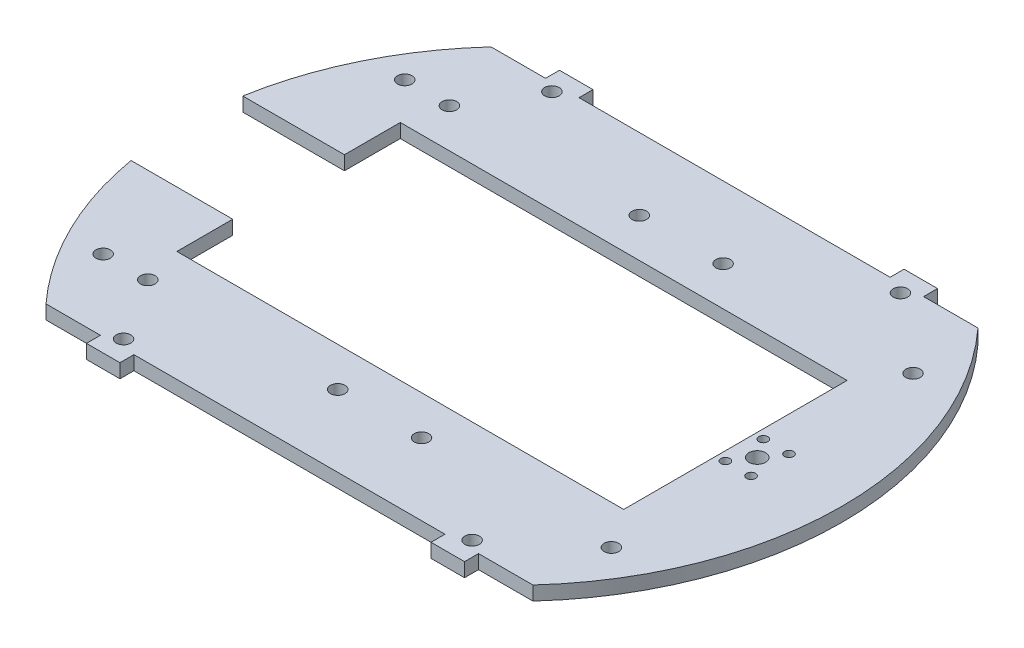
from build123d import *

# Parameters (mm, degrees)
SKETCH1_R           = 1.651
SKETCH1_R_2         = 1.905
SKETCH1_R_3         = 1.016
SKETCH1_W           = 101.6
SKETCH1_H           = 50.8
BOSS_EXTRUDE1_DEPTH = 3.175
SKETCH3_W           = 23.116912814
SKETCH3_H           = 25.4
CUT_EXTRUDE2_DEPTH  = 3.175


with BuildPart() as part:
    # Sketch1 → Boss-Extrude1 (new body)
    with BuildSketch(Plane(origin=(0, 0, 0), x_dir=(1, 0, 0), z_dir=(0, 1, 0))):
        with BuildLine():
            Line((-73.916912814, 12.7), (-73.916912814, -12.7))
            ThreePointArc((-73.916912814, -12.7), (-67.357563081, -32.984218889), (-55.35602635, -50.603461806))
            Line((-55.35602635, -50.603461806), (-42.984152136, -50.603461806))
            Line((-42.984152136, -50.603461806), (-42.984152136, -53.778461806))
            Line((-42.984152136, -53.778461806), (-35.364152136, -53.778461806))
            Line((-35.364152136, -53.778461806), (-35.364152136, -50.603461806))
            Line((-35.364152136, -50.603461806), (35.364152136, -50.603461806))
            Line((35.364152136, -50.603461806), (35.364152136, -53.778461806))
            Line((35.364152136, -53.778461806), (42.984152136, -53.778461806))
            Line((42.984152136, -53.778461806), (42.984152136, -50.603461806))
            Line((42.984152136, -50.603461806), (55.35602635, -50.603461806))
            ThreePointArc((55.35602635, -50.603461806), (75, 0), (55.35602635, 50.603461806))
            Line((55.35602635, 50.603461806), (42.984152136, 50.603461806))
            Line((42.984152136, 50.603461806), (42.984152136, 53.778461806))
            Line((42.984152136, 53.778461806), (35.364152136, 53.778461806))
            Line((35.364152136, 53.778461806), (35.364152136, 50.603461806))
            Line((35.364152136, 50.603461806), (-35.364152136, 50.603461806))
            Line((-35.364152136, 50.603461806), (-35.364152136, 53.778461806))
            Line((-35.364152136, 53.778461806), (-42.984152136, 53.778461806))
            Line((-42.984152136, 53.778461806), (-42.984152136, 50.603461806))
            Line((-42.984152136, 50.603461806), (-55.35602635, 50.603461806))
            ThreePointArc((-55.35602635, 50.603461806), (-67.357563081, 32.984218889), (-73.916912814, 12.7))
        make_face()
        with Locations(Location((13.713087186, 34.29, 0), (0, 0, 270))):
            Circle(SKETCH1_R, mode=Mode.SUBTRACT)
        with Locations(Location((-58.676912814, -34.29, 0), (0, 0, 270))):
            Circle(SKETCH1_R, mode=Mode.SUBTRACT)
        with Locations(Location((-58.676912814, 34.29, 0), (0, 0, 270))):
            Circle(SKETCH1_R, mode=Mode.SUBTRACT)
        with Locations(Location((-39.626912814, 48.698461806, 0), (0, 0, 270))):
            Circle(SKETCH1_R, mode=Mode.SUBTRACT)
        with Locations(Location((39.626912814, 48.698461806, 0), (0, 0, 270))):
            Circle(SKETCH1_R, mode=Mode.SUBTRACT)
        with Locations(Location((-39.626912814, -48.698461806, 0), (0, 0, 270))):
            Circle(SKETCH1_R, mode=Mode.SUBTRACT)
        with Locations(Location((39.626912814, -48.698461806, 0), (0, 0, 270))):
            Circle(SKETCH1_R, mode=Mode.SUBTRACT)
        with Locations(Location((56.893087186, 34.29, 0), (0, 0, 270))):
            Circle(SKETCH1_R, mode=Mode.SUBTRACT)
        with Locations(Location((-48.516912814, 34.29, 0), (0, 0, 270))):
            Circle(SKETCH1_R, mode=Mode.SUBTRACT)
        with Locations(Location((-5.336912814, 34.29, 0), (0, 0, 270))):
            Circle(SKETCH1_R, mode=Mode.SUBTRACT)
        with Locations(Location((-5.336912814, -34.29, 0), (0, 0, 270))):
            Circle(SKETCH1_R, mode=Mode.SUBTRACT)
        with Locations(Location((-48.516912814, -34.29, 0), (0, 0, 270))):
            Circle(SKETCH1_R, mode=Mode.SUBTRACT)
        with Locations(Location((13.713087186, -34.29, 0), (0, 0, 270))):
            Circle(SKETCH1_R, mode=Mode.SUBTRACT)
        with Locations(Location((56.893087186, -34.29, 0), (0, 0, 270))):
            Circle(SKETCH1_R, mode=Mode.SUBTRACT)
        with Locations(Location((55.751543593, 0, 0), (0, 0, 270))):
            Circle(SKETCH1_R_2, mode=Mode.SUBTRACT)
        with Locations(Location((58.671087186, 4.318, 0), (0, 0, 270))):
            Circle(SKETCH1_R_3, mode=Mode.SUBTRACT)
        with Locations(Location((58.671087186, -4.318, 0), (0, 0, 270))):
            Circle(SKETCH1_R_3, mode=Mode.SUBTRACT)
        with Locations(Location((52.832, -4.318, 0), (0, 0, 270))):
            Circle(SKETCH1_R_3, mode=Mode.SUBTRACT)
        with Locations(Location((52.832, 4.318, 0), (0, 0, 270))):
            Circle(SKETCH1_R_3, mode=Mode.SUBTRACT)
        Rectangle(SKETCH1_W, SKETCH1_H, mode=Mode.SUBTRACT)
    extrude(amount=BOSS_EXTRUDE1_DEPTH)

    # Sketch3 → Cut-Extrude2 (cut)
    with BuildSketch(Plane(origin=(0, 3.175, 0), x_dir=(1, 0, 0), z_dir=(0, 1, 0))):
        with Locations((-62.358456407, 0)):
            Rectangle(SKETCH3_W, SKETCH3_H)
    extrude(amount=-CUT_EXTRUDE2_DEPTH, mode=Mode.SUBTRACT)


solid = part.part
